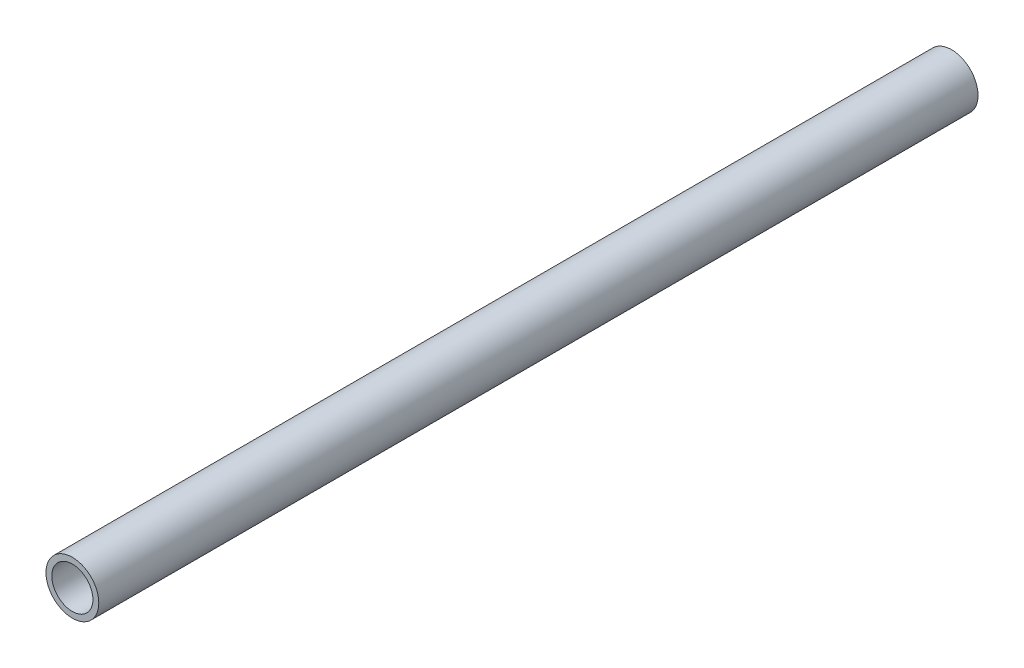
from build123d import *

# Parameters (mm, degrees)
SKETCH1_R           = 9
SKETCH1_R_2         = 7
BOSS_EXTRUDE1_DEPTH = 299.527


with BuildPart() as part:
    # Sketch1 → Boss-Extrude1 (new body)
    with BuildSketch(Plane.XY):
        Circle(SKETCH1_R)
        Circle(SKETCH1_R_2, mode=Mode.SUBTRACT)
    extrude(amount=BOSS_EXTRUDE1_DEPTH)


solid = part.part
